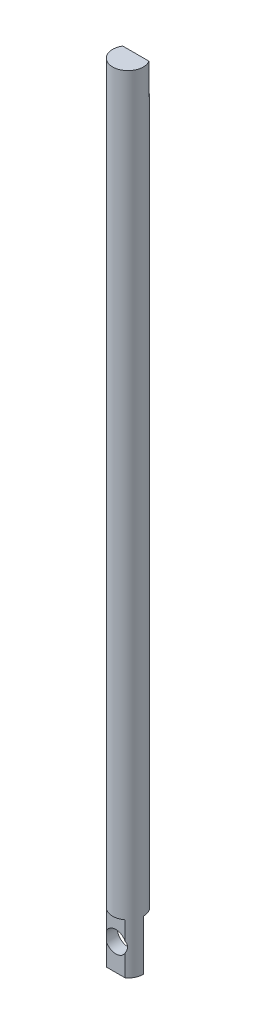
from build123d import *

# Parameters (mm, degrees)
SKETCH1_R               = 1.95
BOSS_EXTRUDE1_DEPTH     = 50
SKETCH2_W               = 3.9
SKETCH2_H               = 6.4
SKETCH2_H_2             = 4
CUT_EXTRUDE1_DEPTH      = 51.075992252
CUT_EXTRUDE2_DEPTH      = 51.075992252
CUT_EXTRUDE2_DEPTH_BACK = 51.075992252
SKETCH3_W               = 0.4
SKETCH3_H               = 6.4
CUT_EXTRUDE3_DEPTH      = 51.075992252
CUT_EXTRUDE3_DEPTH_BACK = 51.075992252
SKETCH4_R               = 1.35
SKETCH5_R               = 1.235
CUT_EXTRUDE4_DEPTH      = 51.075992359
BOSS_EXTRUDE2_DEPTH     = 1
CUT_EXTRUDE5_DEPTH      = 97.039601311


with BuildPart() as part:
    # Sketch1 → Boss-Extrude1 (new, symmetric)
    with BuildSketch(Plane(origin=(0, 0, 0), x_dir=(1, 0, 0), z_dir=(0, 1, 0))):
        with Locations(Location((0, 0, 0), (0, 0, 270))):
            Circle(SKETCH1_R)
    extrude(amount=BOSS_EXTRUDE1_DEPTH, both=True)

    # Sketch2 → Cut-Extrude1 (cut, through all)
    with BuildSketch(Plane.XY):
        with Locations((0, -46.8)):
            Rectangle(SKETCH2_W, SKETCH2_H)
        with Locations((0, 48)):
            Rectangle(SKETCH2_W, SKETCH2_H_2)
    extrude(amount=-CUT_EXTRUDE1_DEPTH, mode=Mode.SUBTRACT)

    # Sketch3 → Cut-Extrude2 (cut, two sides: drawn at the far end of the back side and taken through both)
    with BuildSketch(Plane(origin=(0, 0, 0), x_dir=(0, 0, -1), z_dir=(1, 0, 0)).offset(-CUT_EXTRUDE2_DEPTH_BACK)):
        with Locations((-1.75, -46.8)):
            Rectangle(SKETCH3_W, SKETCH3_H)
    extrude(amount=CUT_EXTRUDE2_DEPTH + CUT_EXTRUDE2_DEPTH_BACK, mode=Mode.SUBTRACT)

    # Sketch4 → Cut-Extrude3 (cut, two sides: drawn at the far end of the back side and taken through both)
    with BuildSketch(Plane(origin=(0, 0, 0), x_dir=(-1, 0, 0), z_dir=(0, 0, -1)).offset(-CUT_EXTRUDE3_DEPTH_BACK)):
        with Locations((0, -46.6)):
            Circle(SKETCH4_R)
    extrude(amount=CUT_EXTRUDE3_DEPTH + CUT_EXTRUDE3_DEPTH_BACK, mode=Mode.SUBTRACT)

    # Sketch5 → Cut-Extrude4 (cut, through all)
    with BuildSketch(Plane(origin=(0, 0, 0), x_dir=(-1, 0, 0), z_dir=(0, 0, -1))):
        with Locations((0, 45.89)):
            Circle(SKETCH5_R)
    extrude(amount=CUT_EXTRUDE4_DEPTH, mode=Mode.SUBTRACT)

    # Sketch6 → Boss-Extrude2 (add)
    with BuildSketch(Plane(origin=(0, 0, 0), x_dir=(-1, 0, 0), z_dir=(0, 0, -1))):
        with BuildLine():
            Line((-1.95, 46), (-1.23009146, 46))
            ThreePointArc((-1.23009146, 46), (0, 47.125), (1.23009146, 46))
            Line((1.23009146, 46), (1.95, 46))
            Line((1.95, 46), (1.95, 50))
            Line((1.95, 50), (-1.95, 50))
            Line((-1.95, 50), (-1.95, 46))
        make_face()
    extrude(amount=BOSS_EXTRUDE2_DEPTH)

    # Sketch7 → Cut-Extrude5 (cut, through all)
    with BuildSketch(Plane.XZ.offset(-46)):
        with BuildLine():
            Line((1.95, -1), (1.95, 0))
            ThreePointArc((1.95, 0), (1.879751375, -0.518685616), (1.674066904, -1))
            Line((1.674066904, -1), (1.95, -1))
        make_face()
        with BuildLine():
            Line((-1.95, -1), (-1.674066904, -1))
            ThreePointArc((-1.674066904, -1), (-1.879751375, -0.518685616), (-1.95, 0))
            Line((-1.95, 0), (-1.95, -1))
        make_face()
    extrude(amount=-CUT_EXTRUDE5_DEPTH, mode=Mode.SUBTRACT)


solid = part.part
